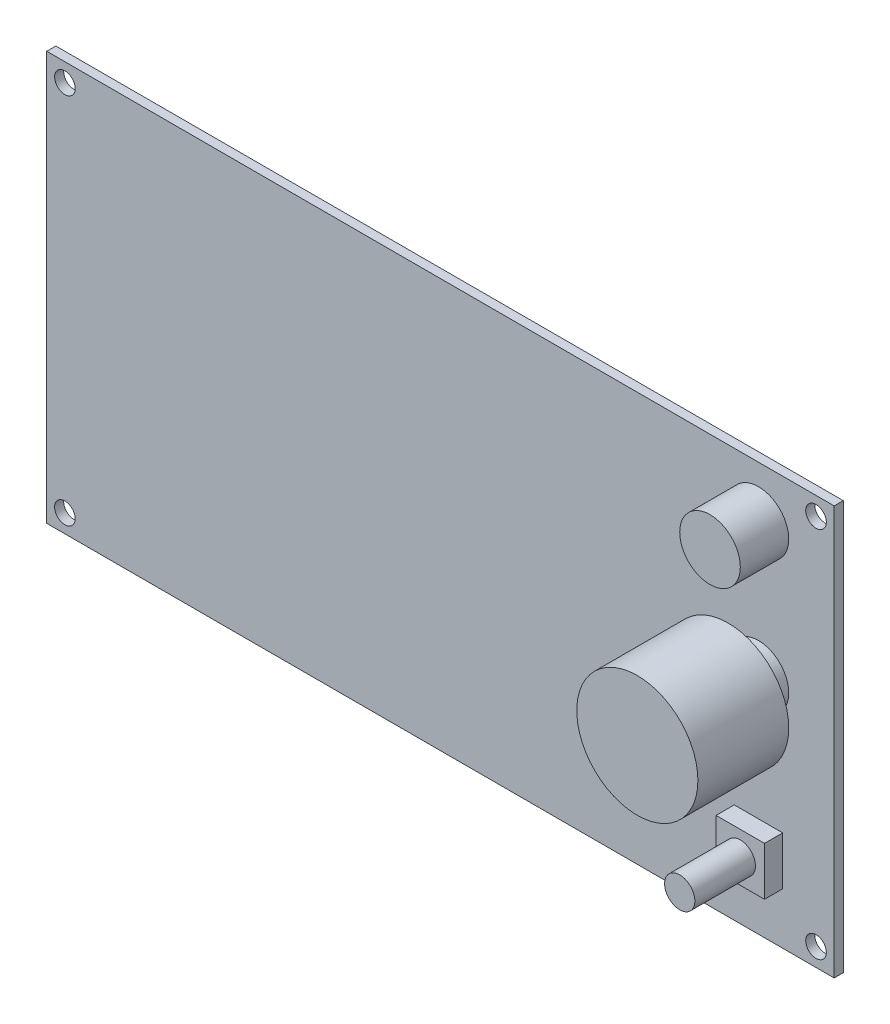
from build123d import *

# Parameters (mm, degrees)
SKETCH1_W           = 130
SKETCH1_H           = 67.5
SKETCH1_R           = 1.7
BOSS_EXTRUDE1_DEPTH = 1.5
SKETCH2_R           = 5
BOSS_EXTRUDE2_DEPTH = 8
SKETCH3_R           = 5
BOSS_EXTRUDE3_DEPTH = 5
SKETCH4_R           = 10
BOSS_EXTRUDE4_DEPTH = 15
SKETCH5_W           = 8
SKETCH5_H           = 8
BOSS_EXTRUDE5_DEPTH = 3
SKETCH6_R           = 2.5
BOSS_EXTRUDE6_DEPTH = 10
SKETCH7_W           = 50
SKETCH7_H           = 7.5
BOSS_EXTRUDE7_DEPTH = 5
SKETCH8_W           = 52
SKETCH8_H           = 1.5
BOSS_EXTRUDE8_DEPTH = 1.5


with BuildPart() as part:
    # Sketch1 → Boss-Extrude1 (new body)
    with BuildSketch(Plane.XY):
        with Locations((62, 30.75)):
            Rectangle(SKETCH1_W, SKETCH1_H)
        Circle(SKETCH1_R, mode=Mode.SUBTRACT)
        with Locations((0, 61.5)):
            Circle(SKETCH1_R, mode=Mode.SUBTRACT)
        with Locations((124, 61.5)):
            Circle(SKETCH1_R, mode=Mode.SUBTRACT)
        with Locations((124, 0)):
            Circle(SKETCH1_R, mode=Mode.SUBTRACT)
    extrude(amount=BOSS_EXTRUDE1_DEPTH)

    # Sketch2 → Boss-Extrude2 (add)
    with BuildSketch(Plane.XY.offset(1.5)):
        with Locations(Location((114.5, 56, 0), (0, 0, 180))):
            Circle(SKETCH2_R)
    extrude(amount=BOSS_EXTRUDE2_DEPTH)

    # Sketch3 → Boss-Extrude3 (add)
    with BuildSketch(Plane.XY.offset(1.5)):
        with Locations(Location((114.5, 34, 0), (0, 0, 180))):
            Circle(SKETCH3_R)
    extrude(amount=BOSS_EXTRUDE3_DEPTH)

    # Sketch4 → Boss-Extrude4 (add)
    with BuildSketch(Plane.XY.offset(6.5)):
        with Locations((114.5, 34)):
            Circle(SKETCH4_R)
    extrude(amount=BOSS_EXTRUDE4_DEPTH)

    # Sketch5 → Boss-Extrude5 (add)
    with BuildSketch(Plane.XY.offset(1.5)):
        with Locations((114.5, 9.5)):
            Rectangle(SKETCH5_W, SKETCH5_H)
    extrude(amount=BOSS_EXTRUDE5_DEPTH)

    # Sketch6 → Boss-Extrude6 (add)
    with BuildSketch(Plane.XY.offset(4.5)):
        with Locations((114.5, 9.5)):
            Circle(SKETCH6_R)
    extrude(amount=BOSS_EXTRUDE6_DEPTH)

    # Sketch7 → Boss-Extrude7 (add)
    with BuildSketch(Plane(origin=(0, 0, 0), x_dir=(-1, 0, 0), z_dir=(0, 0, -1))):
        with Locations((-55, 32.75)):
            Rectangle(SKETCH7_W, SKETCH7_H)
    extrude(amount=BOSS_EXTRUDE7_DEPTH)

    # Sketch8 → Boss-Extrude8 (add)
    with BuildSketch(Plane(origin=(0, 0, 0), x_dir=(-1, 0, 0), z_dir=(0, 0, -1))):
        with Locations((-44.5, -0.25)):
            Rectangle(SKETCH8_W, SKETCH8_H)
    extrude(amount=BOSS_EXTRUDE8_DEPTH)


solid = part.part
